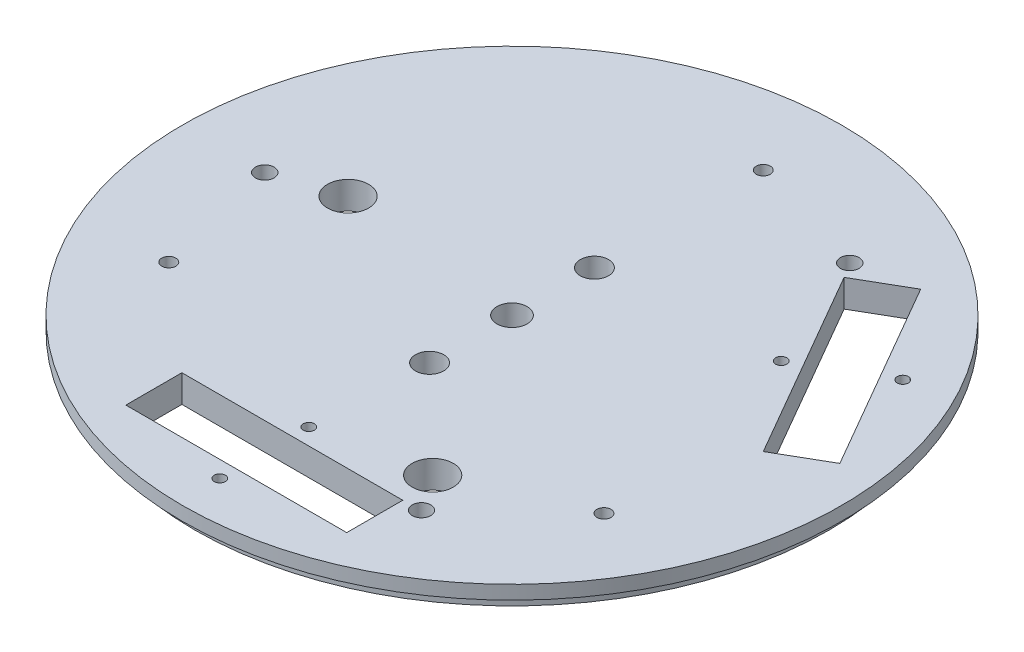
from build123d import *

# Parameters (mm, degrees)
SKETCH1_R                        = 76.1746
BOSS_EXTRUDE1_DEPTH              = 3.175
SKETCH3_R                        = 73.3171
BOSS_EXTRUDE2_DEPTH              = 3.175
F_97_0_0059_DIAMETER_HOLE1_D     = 6.985
F_97_0_0059_DIAMETER_HOLE1_DEPTH = 10.0076
F_97_0_0059_DIAMETER_HOLE1_TIP   = 2.016395815
SKETCH9_R                        = 1.292031205
SKETCH9_W                        = 51.054
SKETCH9_H                        = 12.954
CUT_EXTRUDE1_DEPTH               = 108.914141197
SKETCH11_R                       = 2.159
CUT_EXTRUDE3_DEPTH               = 108.914141197
CIRPATTERN2_COUNT                = 3
SKETCH15_R                       = 4.7625
CUT_EXTRUDE4_DEPTH               = 6.35
HOLE1_D                          = 3.2639
CIRPATTERN3_COUNT                = 3
CIRPATTERN3_ANGLE                = 240
CIRPATTERN4_COUNT                = 2
CIRPATTERN4_ANGLE                = 120


with BuildPart() as part:
    # Sketch1 → Boss-Extrude1 (new body)
    with BuildSketch(Plane(origin=(0, 0, 0), x_dir=(1, 0, 0), z_dir=(0, 1, 0))):
        with Locations(Location((0, 0, 0), (0, 0, 270))):
            Circle(SKETCH1_R)
    extrude(amount=-BOSS_EXTRUDE1_DEPTH)

    # Sketch3 → Boss-Extrude2 (add)
    with BuildSketch(Plane.XZ.offset(3.175)):
        with Locations(Location((0, 0, 0), (0, 0, 270))):
            Circle(SKETCH3_R)
    extrude(amount=BOSS_EXTRUDE2_DEPTH)

    # #97 (0.0059) Diameter Hole1
    with Locations(Plane(origin=(0, -6.35, 0), x_dir=(-1, 0, 0), z_dir=(0, -1, 0))):
        with Locations((0, 0)):
            Hole(F_97_0_0059_DIAMETER_HOLE1_D / 2, depth=F_97_0_0059_DIAMETER_HOLE1_DEPTH)
            with Locations((0, 0, -(F_97_0_0059_DIAMETER_HOLE1_DEPTH + F_97_0_0059_DIAMETER_HOLE1_TIP / 2))):  # 120° drill point
                Cone(0, F_97_0_0059_DIAMETER_HOLE1_D / 2, F_97_0_0059_DIAMETER_HOLE1_TIP, mode=Mode.SUBTRACT)

    # Sketch8 → #97 (0.0059) Diameter Hole3 (revolve, cut)
    with BuildSketch(Plane(origin=(0, 0, -19.05), x_dir=(0, 0, 1), z_dir=(1, 0, 0))):
        Polygon((0, 0), (0, 11.892013544), (3.2639, 10.0076), (3.2639, 0), align=None)
    f_97_0_0059_diameter_hole3 = revolve(axis=Axis((0, 6.35, -19.05), (0, -1, 0)), mode=Mode.SUBTRACT)

    # Mirror1: #97 (0.0059) Diameter Hole3 across plane
    add(f_97_0_0059_diameter_hole3.mirror(Plane.XY), mode=Mode.SUBTRACT)

    # Sketch9 → Cut-Extrude1 (cut, through all)
    with BuildSketch(Plane(origin=(0, 0, 0), x_dir=(1, 0, 0), z_dir=(0, 1, 0))):
        with Locations(Location((-1.1176, -66.421, 0), (0, 0, 270))):
            Circle(SKETCH9_R)
        with Locations(Location((-1.1176, -45.847, 0), (0, 0, 90))):
            Circle(SKETCH9_R)
        with Locations((-1.1176, -56.134)):
            Rectangle(SKETCH9_W, SKETCH9_H)
    cut_extrude1 = extrude(amount=-CUT_EXTRUDE1_DEPTH, mode=Mode.SUBTRACT)

    # Sketch11 → Cut-Extrude3 (cut, symmetric)
    with BuildSketch(Plane(origin=(0, 0, 0), x_dir=(1, 0, 0), z_dir=(0, 1, 0))):
        with Locations(Location((28.575, 49.493351826, 0), (0, 0, 270))):
            Circle(SKETCH11_R)
    cut_extrude3 = extrude(amount=CUT_EXTRUDE3_DEPTH, both=True, mode=Mode.SUBTRACT)

    # CirPattern2: Cut-Extrude3 ×3 about axis
    cirpattern2_axis = Axis((0, 0, 0), (0, 1, 0))
    for i in range(1, CIRPATTERN2_COUNT):
        add(cut_extrude3.rotate(cirpattern2_axis, i * 360 / CIRPATTERN2_COUNT), mode=Mode.SUBTRACT)

    # Sketch15 → Cut-Extrude4 (cut)
    with BuildSketch(Plane(origin=(0, 0, 0), x_dir=(1, 0, 0), z_dir=(0, 1, 0))):
        with Locations(Location((-42.7800008, 4.89000038, 0), (0, 0, 270))):
            Circle(SKETCH15_R)
        with Locations(Location((22.86, -41.1899989, 0), (0, 0, 270))):
            Circle(SKETCH15_R)
    extrude(amount=-CUT_EXTRUDE4_DEPTH, mode=Mode.SUBTRACT)

    # Hole1 (through all)
    with Locations(Plane(origin=(0, 0, 0), x_dir=(1, 0, 0), z_dir=(0, 1, 0))):
        with Locations((0, 58.07456)):
            hole1 = Hole(HOLE1_D / 2)

    # CirPattern3: Hole1 ×3 about axis
    cirpattern3_axis = Axis((0, 0, 0), (0, 1, 0))
    for i in range(1, CIRPATTERN3_COUNT):
        add(hole1.rotate(cirpattern3_axis, i * CIRPATTERN3_ANGLE / (CIRPATTERN3_COUNT - 1)), mode=Mode.SUBTRACT)

    # CirPattern4: Cut-Extrude1 ×2 about axis
    cirpattern4_axis = Axis((0, 0, 0), (0, 1, 0))
    for i in range(1, CIRPATTERN4_COUNT):
        add(cut_extrude1.rotate(cirpattern4_axis, i * CIRPATTERN4_ANGLE / (CIRPATTERN4_COUNT - 1)), mode=Mode.SUBTRACT)


solid = part.part
